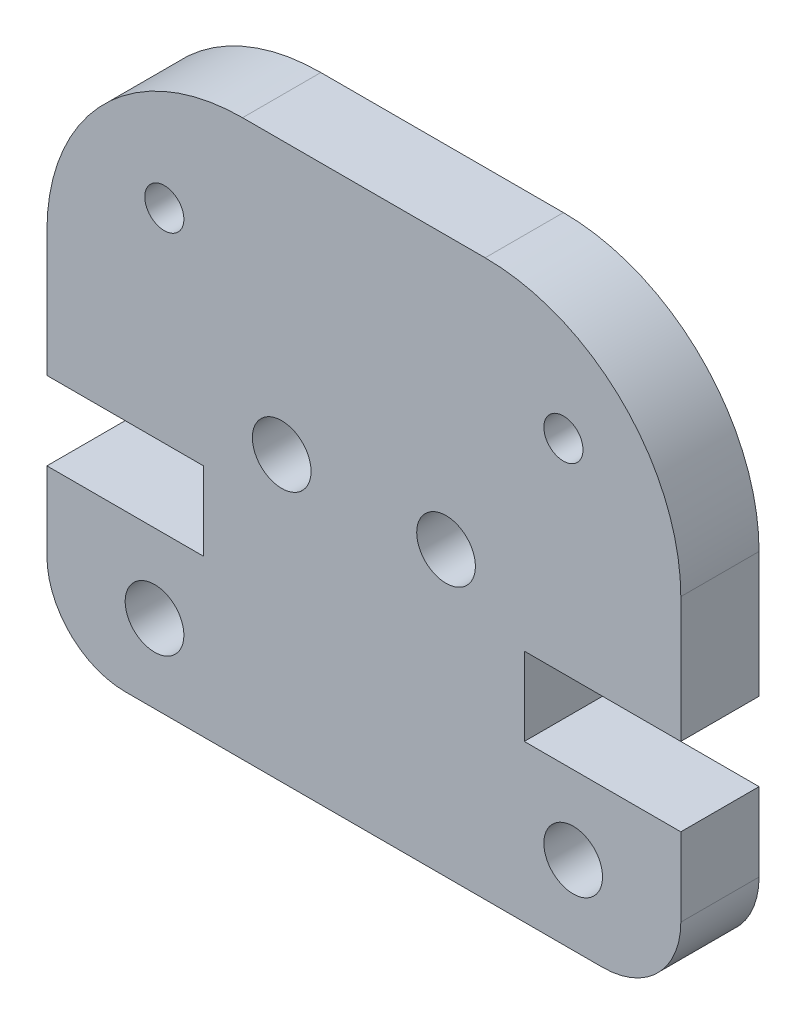
from build123d import *

# Parameters (mm, degrees)
SKETCH1_R           = 0.75
SKETCH1_R_2         = 0.5
BOSS_EXTRUDE1_DEPTH = 2


with BuildPart() as part:
    # Sketch1 → Boss-Extrude1 (new body)
    with BuildSketch(Plane.XY):
        with BuildLine():
            Line((12.2, 4), (16.2, 4))
            Line((16.2, 4), (16.2, 2))
            ThreePointArc((16.2, 2), (15.614213562, 0.585786438), (14.2, 0))
            Line((14.2, 0), (2, 0))
            ThreePointArc((2, 0), (0.585786438, 0.585786438), (0, 2))
            Line((0, 2), (0, 4))
            Line((0, 4), (4, 4))
            Line((4, 4), (4, 6))
            Line((4, 6), (0, 6))
            Line((0, 6), (0, 9.205))
            ThreePointArc((0, 9.205), (1.464466094, 12.740533906), (5, 14.205))
            Line((5, 14.205), (11.2, 14.205))
            ThreePointArc((11.2, 14.205), (14.735533906, 12.740533906), (16.2, 9.205))
            Line((16.2, 9.205), (16.2, 6))
            Line((16.2, 6), (12.2, 6))
            Line((12.2, 6), (12.2, 4))
        make_face()
        with Locations(Location((13.45, 2, 0), (0, 0, 180))):
            Circle(SKETCH1_R, mode=Mode.SUBTRACT)
        with Locations(Location((13.2, 11.205, 0), (0, 0, 180))):
            Circle(SKETCH1_R_2, mode=Mode.SUBTRACT)
        with Locations(Location((10.2, 7.25, 0), (0, 0, 180))):
            Circle(SKETCH1_R, mode=Mode.SUBTRACT)
        with Locations((6, 7.25)):
            Circle(SKETCH1_R, mode=Mode.SUBTRACT)
        with Locations((3, 11.205)):
            Circle(SKETCH1_R_2, mode=Mode.SUBTRACT)
        with Locations((2.75, 2)):
            Circle(SKETCH1_R, mode=Mode.SUBTRACT)
    extrude(amount=BOSS_EXTRUDE1_DEPTH)


solid = part.part
